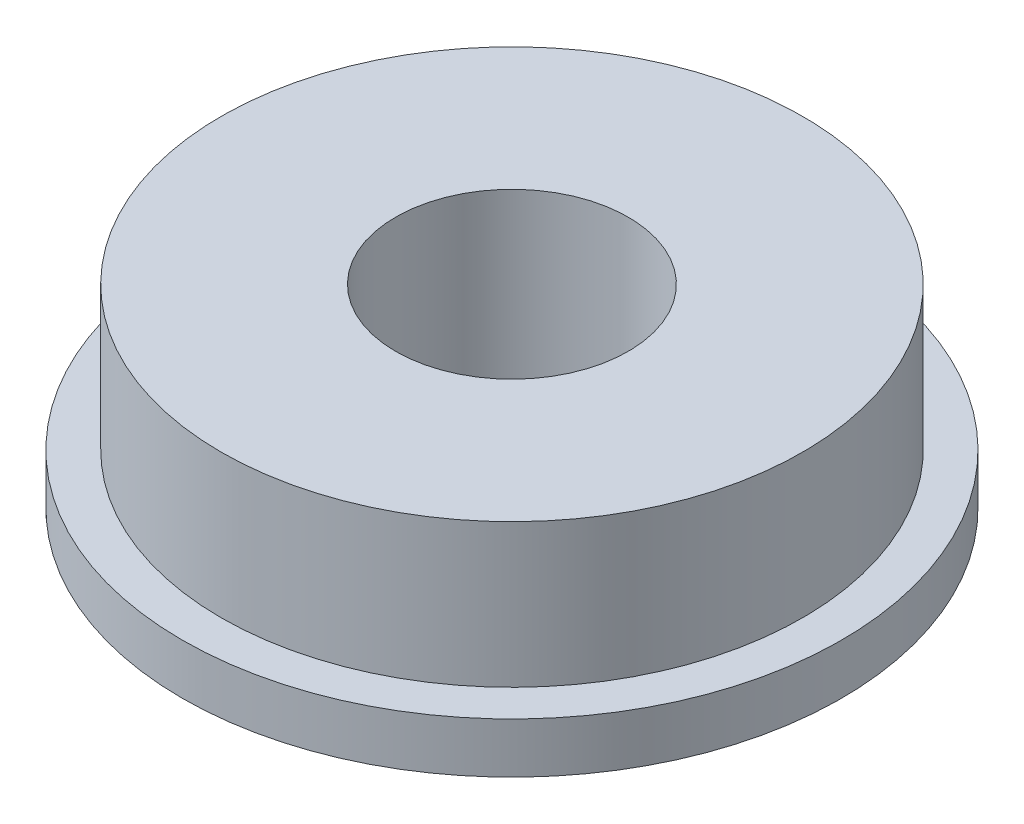
from build123d import *


with BuildPart() as part:
    # 草图1 → 旋转1 (revolve)
    with BuildSketch(Plane.XY, mode=Mode.PRIVATE) as revolve_1_sk:
        Polygon((-3, 0), (-8.5, 0), (-8.5, 1.3), (-7.5, 1.3), (-7.5, 5), (-3, 5), align=None)
    revolve(revolve_1_sk.sketch.rotate(Axis((0, 9.416666667, 0), (0, -1, 0)), 270), axis=Axis((0, 9.416666667, 0), (0, -1, 0)))


solid = part.part
